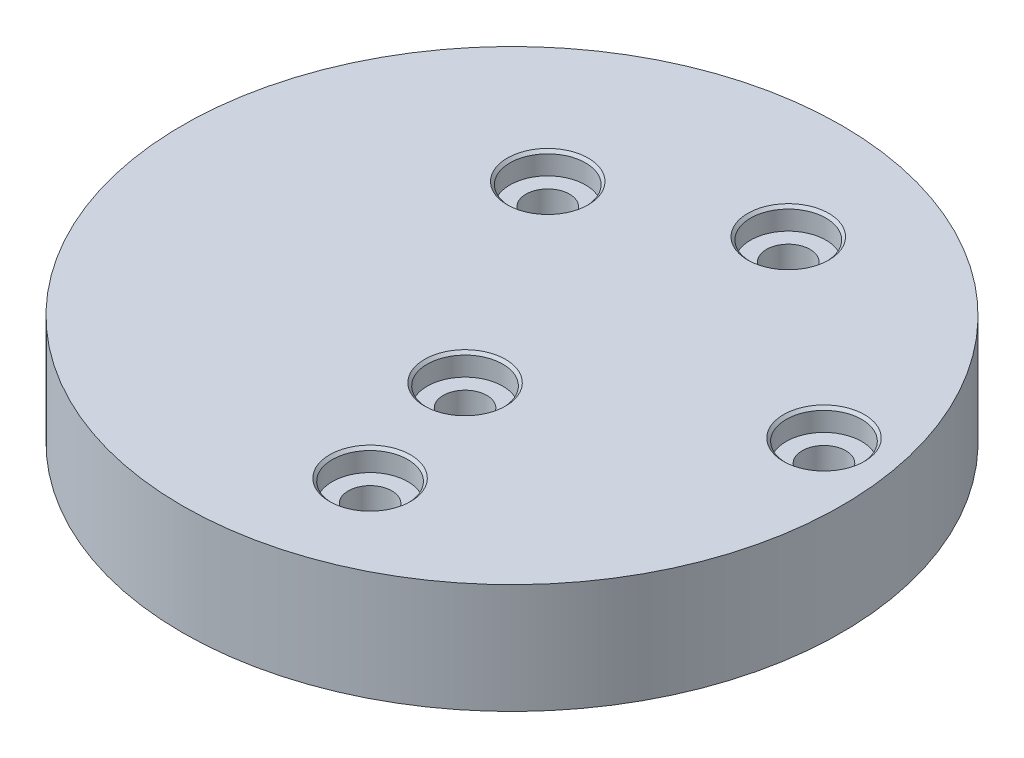
from build123d import *

# Parameters (mm, degrees)
SKETCH1_R                                     = 76.2
BOSS_EXTRUDE1_DEPTH                           = 25.4
CBORE_FOR_3_8_BUTTON_HEAD_CAP_SCREW1_AT_COUNT = 2
CBORE_FOR_3_8_BUTTON_HEAD_CAP_SCREW1_AT_PITCH = 75.078270051
CBORE_FOR_3_8_BUTTON_HEAD_CAP_SCREW1_2_COUNT  = 2
CBORE_FOR_3_8_BUTTON_HEAD_CAP_SCREW1_2_PITCH  = 60.736241383
CBORE_FOR_3_8_BUTTON_HEAD_CAP_SCREW1_3_COUNT  = 2
CBORE_FOR_3_8_BUTTON_HEAD_CAP_SCREW1_3_PITCH  = 85.541398896
CBORE_FOR_3_8_BUTTON_HEAD_CAP_SCREW1_4_COUNT  = 2
CBORE_FOR_3_8_BUTTON_HEAD_CAP_SCREW1_4_PITCH  = 57.302034519


with BuildPart() as part:
    # Sketch1 → Boss-Extrude1 (new body)
    with BuildSketch(Plane(origin=(0, 0, 0), x_dir=(1, 0, 0), z_dir=(0, 1, 0))):
        with Locations(Location((0, 0, 0), (0, 0, 270))):
            Circle(SKETCH1_R)
    extrude(amount=-BOSS_EXTRUDE1_DEPTH)

    # Sketch4 → CBORE for 3/8 Button Head Cap Screw1 (revolve, cut)
    with BuildSketch(Plane(origin=(60.58130803, 0, -11.552884304), x_dir=(0, 0, 1), z_dir=(1, 0, 0))):
        Polygon((0, 0), (0, 25.4), (5.0419, 25.4), (5.0419, 5.0546), (8.73125, 5.0546), (8.73125, 0.635), (9.36625, 0), align=None)
    cbore_for_3_8_button_head_cap_screw1 = revolve(axis=Axis((60.58130803, 6.35, -11.552884304), (0, -1, 0)), mode=Mode.SUBTRACT)

    # CBORE for 3/8 Button Head Cap Screw1 at: CBORE for 3/8 Button Head Cap Screw1 ×2
    with Locations(*[Vector(-0.5918446125142773, 0, 0.8060520793582913) * (i * CBORE_FOR_3_8_BUTTON_HEAD_CAP_SCREW1_AT_PITCH) for i in range(1, CBORE_FOR_3_8_BUTTON_HEAD_CAP_SCREW1_AT_COUNT)]):
        add(cbore_for_3_8_button_head_cap_screw1, mode=Mode.SUBTRACT)

    # CBORE for 3_8 Button Head Cap Screw1 2: CBORE for 3/8 Button Head Cap Screw1 ×2
    with Locations(*[Vector(-0.8654863573421582, 0, 0.5009324957063599) * (i * CBORE_FOR_3_8_BUTTON_HEAD_CAP_SCREW1_2_PITCH) for i in range(1, CBORE_FOR_3_8_BUTTON_HEAD_CAP_SCREW1_2_COUNT)]):
        add(cbore_for_3_8_button_head_cap_screw1, mode=Mode.SUBTRACT)

    # CBORE for 3_8 Button Head Cap Screw1 3: CBORE for 3/8 Button Head Cap Screw1 ×2
    with Locations(*[Vector(-0.9738464853959384, 0, -0.22720700447384592) * (i * CBORE_FOR_3_8_BUTTON_HEAD_CAP_SCREW1_3_PITCH) for i in range(1, CBORE_FOR_3_8_BUTTON_HEAD_CAP_SCREW1_3_COUNT)]):
        add(cbore_for_3_8_button_head_cap_screw1, mode=Mode.SUBTRACT)

    # CBORE for 3_8 Button Head Cap Screw1 4: CBORE for 3/8 Button Head Cap Screw1 ×2
    with Locations(*[Vector(-0.7754466315152058, 0, -0.6314131149031676) * (i * CBORE_FOR_3_8_BUTTON_HEAD_CAP_SCREW1_4_PITCH) for i in range(1, CBORE_FOR_3_8_BUTTON_HEAD_CAP_SCREW1_4_COUNT)]):
        add(cbore_for_3_8_button_head_cap_screw1, mode=Mode.SUBTRACT)


solid = part.part
